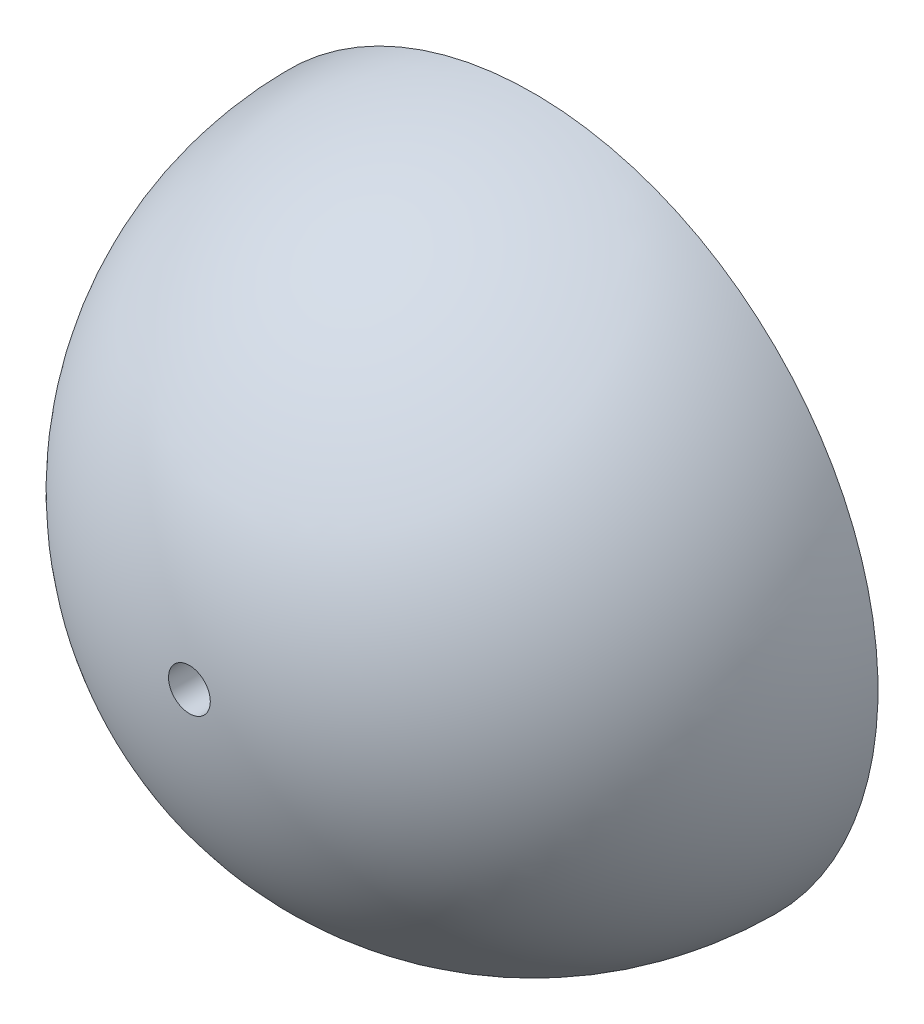
from build123d import *

# Parameters (mm, degrees)
REVOLVE1_ANGLE          = 180
CUT_EXTRUDE5_DEPTH      = 1429.941916244
CUT_EXTRUDE5_DEPTH_BACK = 1429.941916244
SKETCH2_R               = 50


with BuildPart() as part:
    # Sketch1 → Revolve1 (revolve)
    with BuildSketch(Plane.XY):
        with BuildLine():
            Line((0, 825), (0, 700))
            ThreePointArc((0, 700), (700, 0), (0, -700))
            Line((0, -700), (0, -825))
            ThreePointArc((0, -825), (825, 0), (0, 825))
        make_face()
    revolve(axis=Axis((0, -700, 0), (0, -1, 0)), revolution_arc=REVOLVE1_ANGLE)

    # Sketch2 → Cut-Extrude5 (cut, two sides: drawn at the far end of the back side and taken through both)
    with BuildSketch(Plane.XY.offset(-CUT_EXTRUDE5_DEPTH_BACK)):
        Circle(SKETCH2_R)
    extrude(amount=CUT_EXTRUDE5_DEPTH + CUT_EXTRUDE5_DEPTH_BACK, mode=Mode.SUBTRACT)


solid = part.part
